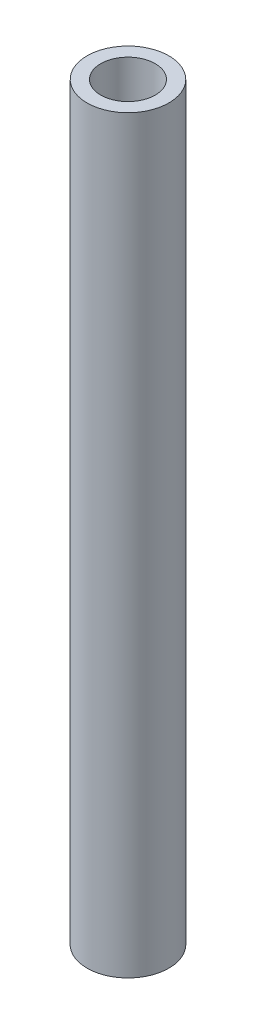
from build123d import *

# Parameters (mm, degrees)
SKETCH2_R           = 3
BOSS_EXTRUDE1_DEPTH = 55
SKETCH3_R           = 2
CUT_EXTRUDE1_DEPTH  = 56.163393659


with BuildPart() as part:
    # Sketch2 → Boss-Extrude1 (new body)
    with BuildSketch(Plane(origin=(0, 0, 0), x_dir=(1, 0, 0), z_dir=(0, 1, 0))):
        with Locations(Location((0, 0, 0), (0, 0, 270))):
            Circle(SKETCH2_R)
    extrude(amount=BOSS_EXTRUDE1_DEPTH)

    # Sketch3 → Cut-Extrude1 (cut, through all)
    with BuildSketch(Plane(origin=(0, 55, 0), x_dir=(1, 0, 0), z_dir=(0, 1, 0))):
        with Locations(Location((0, 0, 0), (0, 0, 270))):
            Circle(SKETCH3_R)
    extrude(amount=-CUT_EXTRUDE1_DEPTH, mode=Mode.SUBTRACT)


solid = part.part
